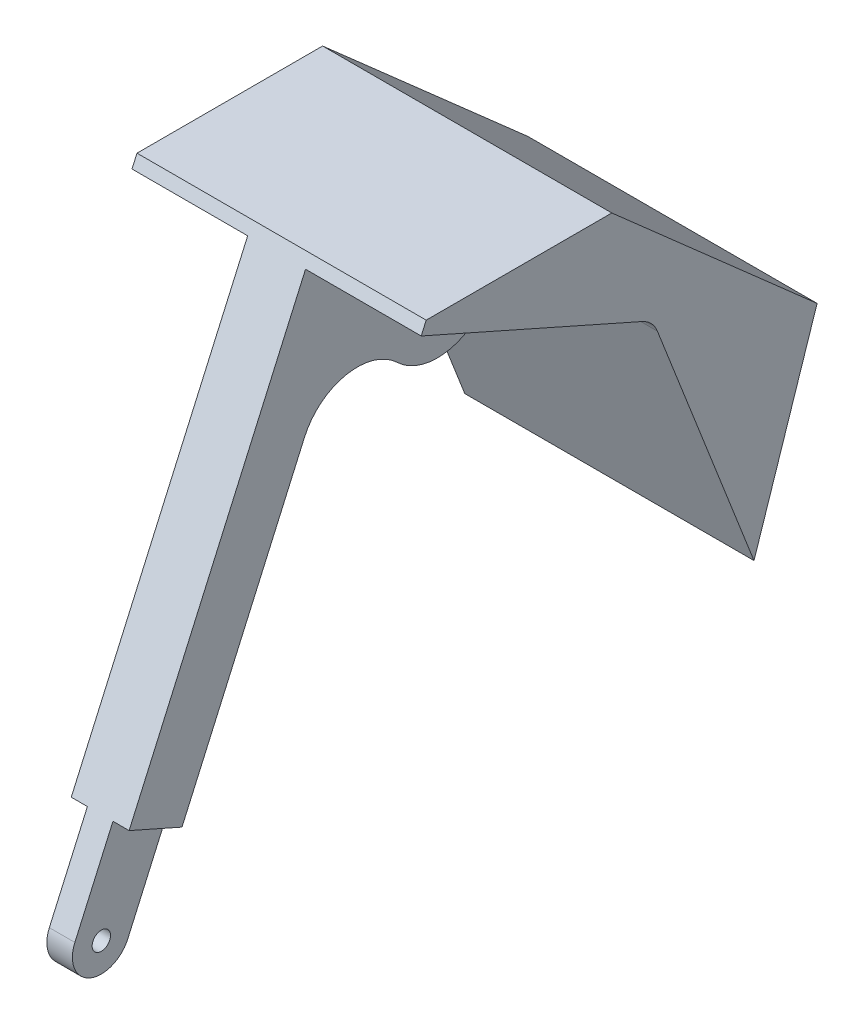
from build123d import *

# Parameters (mm, degrees)
SKETCH1_R           = 3.175
BOSS_EXTRUDE1_DEPTH = 50
CUT_EXTRUDE2_DEPTH  = 85
CUT_EXTRUDE3_DEPTH  = 5


with BuildPart() as part:
    # Sketch1 → Boss-Extrude1 (new, symmetric)
    with BuildSketch(Plane(origin=(0, 0, 0), x_dir=(0, 0, -1), z_dir=(1, 0, 0))):
        with BuildLine():
            Line((81.651944222, 112.683382271), (59.836598551, 46.569389334))
            Line((59.836598551, 46.569389334), (26.418811763, 131.99560075))
            ThreePointArc((26.418811763, 131.99560075), (17.598489936, 138.340405822), (8.196783623, 132.894072472))
            ThreePointArc((8.196783623, 132.894072472), (-6.288509671, 122.256846087), (-23.465130006, 127.542488985))
            ThreePointArc((-23.465130006, 127.542488985), (-41.174252563, 132.730696676), (-55.592419973, 121.213450072))
            Line((-55.592419973, 121.213450072), (-111.125559912, -4.052805204))
            ThreePointArc((-111.125559912, -4.052805204), (-124.320288873, -9.141923757), (-129.409407426, 4.052805204))
            Line((-129.409407426, 4.052805204), (-53.514907077, 175.248236709))
            Line((-53.514907077, 175.248236709), (10.663375069, 175.248236709))
            Line((10.663375069, 175.248236709), (81.651944222, 112.683382271))
        make_face()
        with Locations(Location((-120.267483669, 0, 0), (0, 0, 180))):
            Circle(SKETCH1_R, mode=Mode.SUBTRACT)
        with Locations(Location((-9.621687552, 141.977138307, 0), (0, 0, 180))):
            Circle(SKETCH1_R, mode=Mode.SUBTRACT)
    extrude(amount=BOSS_EXTRUDE1_DEPTH, both=True)

    # Sketch3 → Cut-Extrude2 (cut)
    with BuildSketch(Plane(origin=(0, -60.961450511, 158.231581065), x_dir=(1, 0, 0), z_dir=(0, -0.40528052042874013, -0.9141923756852326))):
        Polygon((50, -254.130320218), (10, -254.130320218), (10, -103.605584332), (4.413734497, -103.605584332), (4.413734497, -45.786353236), (50, -45.786353236), align=None)
        Polygon((-50, -254.130320218), (-50, -45.786353236), (-4.413734497, -45.786353236), (-4.413734497, -103.605584332), (-10, -103.605584332), (-10, -254.130320218), align=None)
    extrude(amount=CUT_EXTRUDE2_DEPTH, mode=Mode.SUBTRACT)

    # Sketch4 → Cut-Extrude3 (cut, symmetric)
    with BuildSketch(Plane(origin=(0, 0, 0), x_dir=(0, 0, -1), z_dir=(1, 0, 0))):
        Polygon((-15.368692055, 153.687872136), (12.057079216, 141.529456524), (-11.845454529, 87.612445941), (-39.271225799, 99.770861554), align=None)
    extrude(amount=CUT_EXTRUDE3_DEPTH, both=True, mode=Mode.SUBTRACT)


solid = part.part
